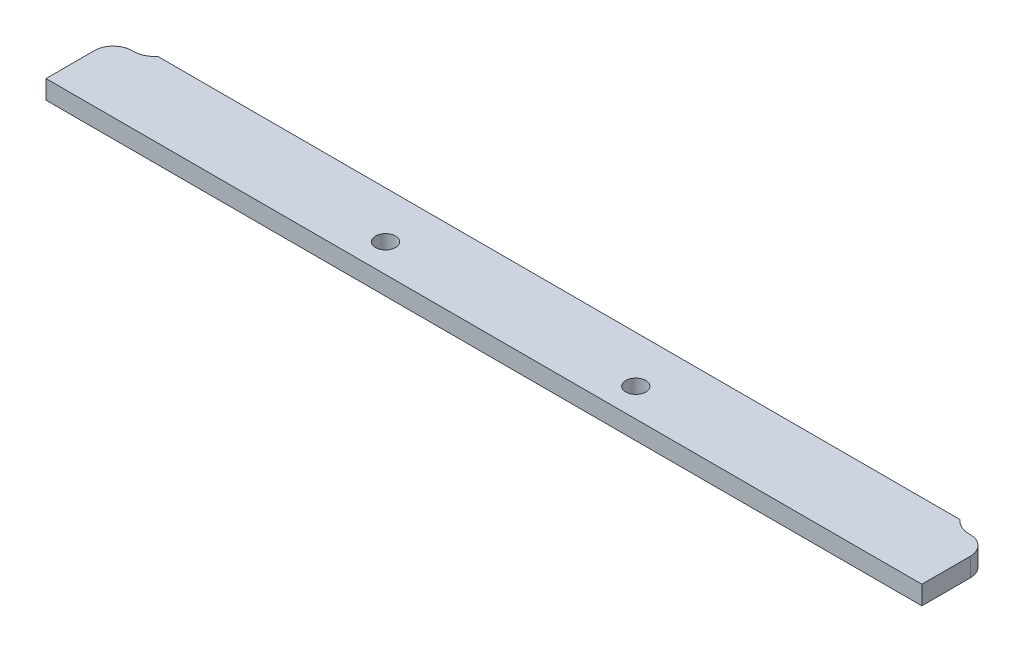
from build123d import *

# Parameters (mm, degrees)
BOSS_EXTRUDE1_DEPTH = 3
CUT_EXTRUDE1_DEPTH  = 1
CUT_EXTRUDE2_REACH  = 136.027


with BuildPart() as part:
    # Sketch1 → Boss-Extrude1 (new body)
    with BuildSketch(Plane(origin=(0, 0, 0), x_dir=(1, 0, 0), z_dir=(0, 1, 0))):
        with BuildLine():
            Line((-5.431022837, 25.099874039), (-5.62533215, 25.099874039))
            ThreePointArc((-5.62533215, 25.099874039), (-7.746652493, 24.221194382), (-8.62533215, 22.099874039))
            Line((-8.62533215, 22.099874039), (-8.62533215, 14.358894177))
            Line((-8.62533215, 14.358894177), (131.37466785, 14.358894177))
            Line((131.37466785, 14.358894177), (131.37466785, 22.099874039))
            ThreePointArc((131.37466785, 22.099874039), (130.495988194, 24.221194382), (128.37466785, 25.099874039))
            Line((128.37466785, 25.099874039), (128.180358538, 25.099874039))
            ThreePointArc((128.180358538, 25.099874039), (126.694892152, 25.430743303), (125.49028015, 26.360794257))
            Line((125.49028015, 26.360794257), (-2.74094445, 26.360794257))
            ThreePointArc((-2.74094445, 26.360794257), (-3.945556452, 25.430743303), (-5.431022837, 25.099874039))
        make_face()
    extrude(amount=BOSS_EXTRUDE1_DEPTH)

    # Sketch2 → Cut-Extrude1 (cut)
    with BuildSketch(Plane.XZ):
        Polygon((5.157574014, -18.873414802), (5.80470943, -18.873414802), (5.80470943, -22.373414802), (5.490606866, -22.373414802), (5.490606866, -19.232389161), (4.952145328, -19.232389161), align=None)
    extrude(amount=-CUT_EXTRUDE1_DEPTH, mode=Mode.SUBTRACT)

    # Sketch3 → Cut-Extrude2 (cut, up to next)
    with BuildSketch(Plane(origin=(0, 3, 0), x_dir=(1, 0, 0), z_dir=(0, 1, 0)), mode=Mode.PRIVATE) as cut_extrude2_sk1:
        with BuildLine():
            ThreePointArc((41.109797099, 17.303114067), (42.709797099, 18.903114067), (41.109797099, 20.503114067))
            ThreePointArc((41.109797099, 20.503114067), (39.509797099, 18.903114067), (41.109797099, 17.303114067))
        make_face()
    cut_extrude2_tool1 = extrude(cut_extrude2_sk1.sketch, amount=-CUT_EXTRUDE2_REACH, mode=Mode.PRIVATE) & part.part
    # Sketch3 → Cut-Extrude2 (cut, up to next)
    with BuildSketch(Plane(origin=(0, 3, 0), x_dir=(1, 0, 0), z_dir=(0, 1, 0)), mode=Mode.PRIVATE) as cut_extrude2_sk2:
        with BuildLine():
            ThreePointArc((81.109797099, 17.303114067), (82.709797099, 18.903114067), (81.109797099, 20.503114067))
            ThreePointArc((81.109797099, 20.503114067), (79.509797099, 18.903114067), (81.109797099, 17.303114067))
        make_face()
    cut_extrude2_tool2 = extrude(cut_extrude2_sk2.sketch, amount=-CUT_EXTRUDE2_REACH, mode=Mode.PRIVATE) & part.part
    add(cut_extrude2_tool1.solids().sort_by_distance((41.109797, 3, -18.903114))[0], mode=Mode.SUBTRACT)
    add(cut_extrude2_tool2.solids().sort_by_distance((81.109797, 3, -18.903114))[0], mode=Mode.SUBTRACT)


solid = part.part
